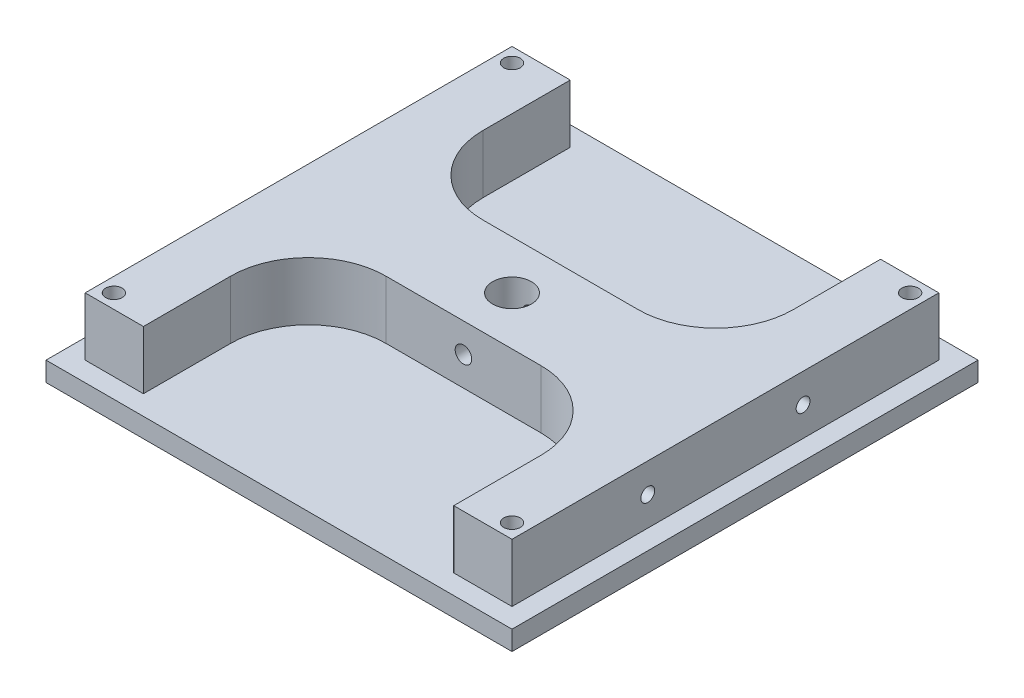
from build123d import *

# Parameters (mm, degrees)
SKETCH1_W             = 76.2
SKETCH1_H             = 76.2
BOSS_EXTRUDE1_DEPTH   = 3.175
SKETCH2_W             = 69.79412
SKETCH2_H             = 69.79412
BOSS_EXTRUDE2_DEPTH   = 9.525
F_6_32_TAPPED_HOLE1_D = 2.7051
CIRPATTERN1_COUNT     = 4
SKETCH14_R            = 3.175
CUT_EXTRUDE1_DEPTH    = 56.358016583
SKETCH15_W            = 50.74412
SKETCH15_H            = 26.95956
CUT_EXTRUDE2_DEPTH    = 9.525
FILLET1_R             = 12.7
FILLET1_OF_MIRROR3_R  = 12.7


with BuildPart() as part:
    # Sketch1 → Boss-Extrude1 (new body)
    with BuildSketch(Plane(origin=(0, 0, 0), x_dir=(1, 0, 0), z_dir=(0, 1, 0))):
        Rectangle(SKETCH1_W, SKETCH1_H)
    extrude(amount=BOSS_EXTRUDE1_DEPTH)

    # Sketch2 → Boss-Extrude2 (add)
    with BuildSketch(Plane(origin=(0, 3.175, 0), x_dir=(1, 0, 0), z_dir=(0, 1, 0))):
        Rectangle(SKETCH2_W, SKETCH2_H)
    extrude(amount=BOSS_EXTRUDE2_DEPTH)

    # Sketch9 → #4-40 Tapped Hole1 (revolve, cut)
    with BuildSketch(Plane(origin=(34.89706, 7.9375, 12.7), x_dir=(0, 0, -1), z_dir=(0, 1, 0))):
        Polygon((0, 0), (0, 7.283152758), (1.1303, 6.604), (1.1303, 0), align=None)
    f_4_40_tapped_hole1 = revolve(axis=Axis((41.24706, 7.9375, 12.7), (-1, 0, 0)), mode=Mode.SUBTRACT)

    # Mirror1: #4-40 Tapped Hole1 across plane
    add(f_4_40_tapped_hole1.mirror(Plane.XY), mode=Mode.SUBTRACT)

    # Mirror2 copy 1 sketch → Mirror2 copy 1 (revolve, cut)
    with BuildSketch(Plane(origin=(-34.89706, 7.9375, -12.7), x_dir=(0, 0, 1), z_dir=(0, 1, 0))):
        Polygon((0, 0), (0, 7.283152758), (1.1303, 6.604), (1.1303, 0), align=None)
    revolve(axis=Axis((-41.24706, 7.9375, -12.7), (1, 0, 0)), mode=Mode.SUBTRACT)

    # Mirror2 copy 2 sketch → Mirror2 copy 2 (revolve, cut)
    with BuildSketch(Plane(origin=(-34.89706, 7.9375, 12.7), x_dir=(0, 0, -1), z_dir=(0, 1, 0))):
        Polygon((0, 0), (0, -7.283152758), (1.1303, -6.604), (1.1303, 0), align=None)
    revolve(axis=Axis((-41.24706, 7.9375, 12.7), (-1, 0, 0)), mode=Mode.SUBTRACT)

    # #6-32 Tapped Hole1 (through all)
    with Locations(Plane(origin=(0, 0, 0), x_dir=(-1, 0, 0), z_dir=(0, -1, 0))):
        with Locations((-32.5501, 32.5501)):
            f_6_32_tapped_hole1 = Hole(F_6_32_TAPPED_HOLE1_D / 2)

    # CirPattern1: #6-32 Tapped Hole1 ×4 about axis
    cirpattern1_axis = Axis((0, -0.635, 0), (0, 1, 0))
    for i in range(1, CIRPATTERN1_COUNT):
        add(f_6_32_tapped_hole1.rotate(cirpattern1_axis, i * 360 / CIRPATTERN1_COUNT), mode=Mode.SUBTRACT)

    # Sketch14 → Cut-Extrude1 (cut, through all)
    with BuildSketch(Plane.XZ):
        Circle(SKETCH14_R)
    extrude(amount=-CUT_EXTRUDE1_DEPTH, mode=Mode.SUBTRACT)

    # Sketch15 → Cut-Extrude2 (cut)
    with BuildSketch(Plane(origin=(0, 12.7, 0), x_dir=(1, 0, 0), z_dir=(0, 1, 0))):
        with Locations((0, -21.41728)):
            Rectangle(SKETCH15_W, SKETCH15_H)
    cut_extrude2 = extrude(amount=-CUT_EXTRUDE2_DEPTH, mode=Mode.SUBTRACT)

    # Fillet1
    fillet1_edges = [part.edges().sort_by_distance(p)[0] for p in [
        (25.37206, 7.9375, 7.9375),
        (-25.37206, 7.9375, 7.9375),
    ]]
    fillet(fillet1_edges, radius=FILLET1_R)

    # Sketch17 → #6-32 Tapped Hole2 (revolve, cut)
    with BuildSketch(Plane(origin=(0, 7.9375, 7.9375), x_dir=(0, -1, 0), z_dir=(1, 0, 0))):
        Polygon((0, 0), (0, 10.46469403), (1.35255, 9.652), (1.35255, 0), align=None)
    f_6_32_tapped_hole2 = revolve(axis=Axis((0, 7.9375, 14.2875), (0, 0, -1)), mode=Mode.SUBTRACT)

    # Mirror3: Cut-Extrude2, #6-32 Tapped Hole2 across plane
    add(cut_extrude2.mirror(Plane.XY), mode=Mode.SUBTRACT)
    add(f_6_32_tapped_hole2.mirror(Plane.XY), mode=Mode.SUBTRACT)

    # Fillet1 of Mirror3
    fillet1_of_mirror3_edges = [part.edges().sort_by_distance(p)[0] for p in [
        (25.37206, 7.9375, -7.9375),
        (-25.37206, 7.9375, -7.9375),
    ]]
    fillet(fillet1_of_mirror3_edges, radius=FILLET1_OF_MIRROR3_R)


solid = part.part
